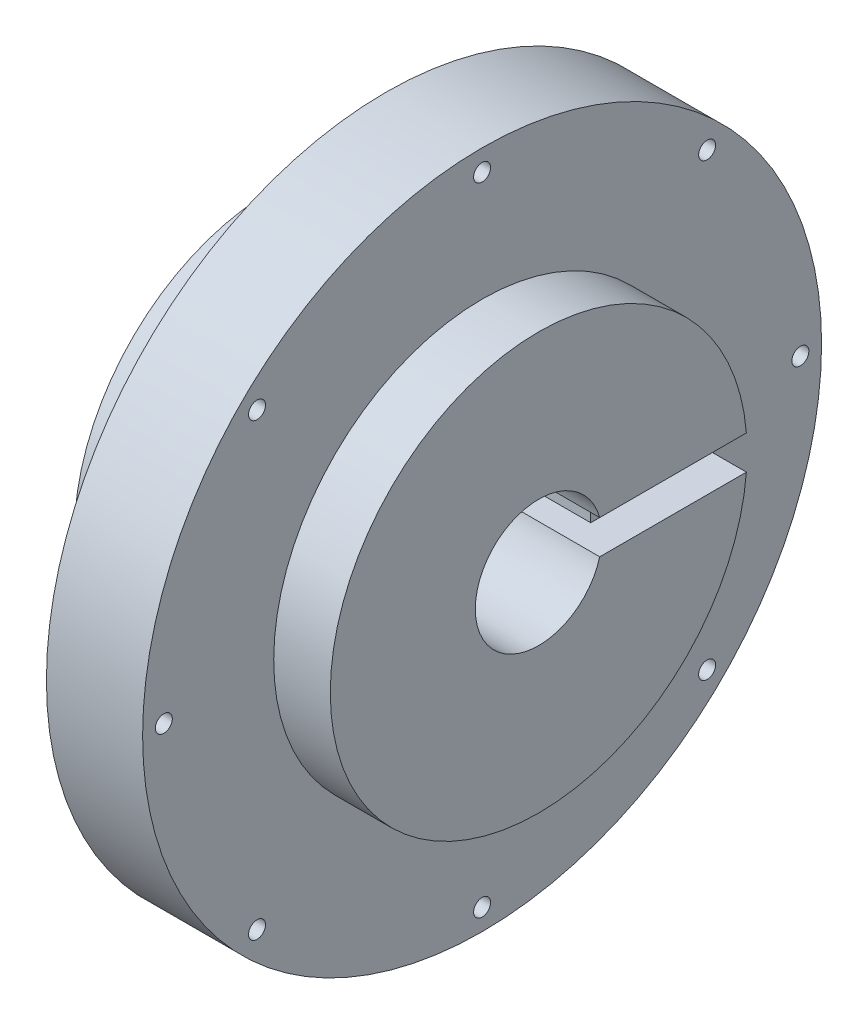
from build123d import *

# Parameters (mm, degrees)
UPPER_CIRLCE_2_R   = 36.83
UPPER_CIRLCE_DEPTH = 10
SKETCH2_R          = 1.5
CUT_EXTRUDE1_DEPTH = 140.185855962
CIRPATTERN1_COUNT  = 8
PIN_SKETCH_R       = 2
CUT_EXTRUDE2_DEPTH = 10
SKETCH3_R          = 11.2
CUT_EXTRUDE3_DEPTH = 29
SKETCH4_W          = 8
SKETCH4_H          = 6
CUT_EXTRUDE4_DEPTH = 70
SKETCH6_W          = 22.346517692
SKETCH6_H          = 6
CUT_EXTRUDE5_DEPTH = 6
SKETCH7_W          = 17.189641189
SKETCH7_H          = 6
CUT_EXTRUDE6_DEPTH = 4


with BuildPart() as part:
    # Sketch1 → Revolve1 (revolve)
    with BuildSketch(Plane.XY, mode=Mode.PRIVATE) as revolve1_sk:
        Polygon((0, 0), (-17, 0), (-17, 25), (-37.05, 25), (-37.05, 60), (0, 60), align=None)
    revolve(revolve1_sk.sketch.rotate(Axis((-37.05, 60, 0), (1, 0, 0)), 270), axis=Axis((-37.05, 60, 0), (1, 0, 0)))

    # upper cirlce 2 → upper cirlce (add)
    with BuildSketch(Plane(origin=(0, 0, 0), x_dir=(0, 0, -1), z_dir=(1, 0, 0))):
        with Locations((0, 60)):
            Circle(UPPER_CIRLCE_2_R)
    extrude(amount=UPPER_CIRLCE_DEPTH)

    # Sketch2 → Cut-Extrude1 (cut, symmetric)
    with BuildSketch(Plane(origin=(0, 0, 0), x_dir=(0, 0, -1), z_dir=(1, 0, 0))):
        with Locations((0, 116.25)):
            Circle(SKETCH2_R)
    cut_extrude1 = extrude(amount=CUT_EXTRUDE1_DEPTH, both=True, mode=Mode.SUBTRACT)

    # CirPattern1: Cut-Extrude1 ×8 about axis
    cirpattern1_axis = Axis((0, 60, 0), (1, 0, 0))
    for i in range(1, CIRPATTERN1_COUNT):
        add(cut_extrude1.rotate(cirpattern1_axis, i * 360 / CIRPATTERN1_COUNT), mode=Mode.SUBTRACT)

    # pin sketch → Cut-Extrude2 (cut)
    with BuildSketch(Plane.ZY.offset(37.05)):
        with Locations((-18.56, 78.56)):
            Circle(PIN_SKETCH_R)
        with Locations((18.56, 78.56)):
            Circle(PIN_SKETCH_R)
        with Locations((18.56, 41.44)):
            Circle(PIN_SKETCH_R)
        with Locations((-18.56, 41.44)):
            Circle(PIN_SKETCH_R)
    extrude(amount=-CUT_EXTRUDE2_DEPTH, mode=Mode.SUBTRACT)

    # Sketch3 → Cut-Extrude3 (cut)
    with BuildSketch(Plane(origin=(10, 0, 0), x_dir=(0, 0, -1), z_dir=(1, 0, 0))):
        with Locations((0, 60)):
            Circle(SKETCH3_R)
    extrude(amount=-CUT_EXTRUDE3_DEPTH, mode=Mode.SUBTRACT)

    # Sketch4 → Cut-Extrude4 (cut)
    with BuildSketch(Plane(origin=(-19, 0, 0), x_dir=(0, 0, -1), z_dir=(1, 0, 0))):
        with Locations((11.2, 60)):
            Rectangle(SKETCH4_W, SKETCH4_H)
    extrude(amount=CUT_EXTRUDE4_DEPTH, mode=Mode.SUBTRACT)

    # Sketch6 → Cut-Extrude5 (cut)
    with BuildSketch(Plane(origin=(10, 0, 0), x_dir=(0, 0, -1), z_dir=(1, 0, 0))):
        with Locations((26.373258846, 60)):
            Rectangle(SKETCH6_W, SKETCH6_H)
    extrude(amount=-CUT_EXTRUDE5_DEPTH, mode=Mode.SUBTRACT)

    # Sketch7 → Cut-Extrude6 (cut)
    with BuildSketch(Plane(origin=(-19, 0, 0), x_dir=(0, 0, -1), z_dir=(1, 0, 0))):
        with Locations((6.605179406, 60)):
            Rectangle(SKETCH7_W, SKETCH7_H)
    extrude(amount=-CUT_EXTRUDE6_DEPTH, mode=Mode.SUBTRACT)


solid = part.part
